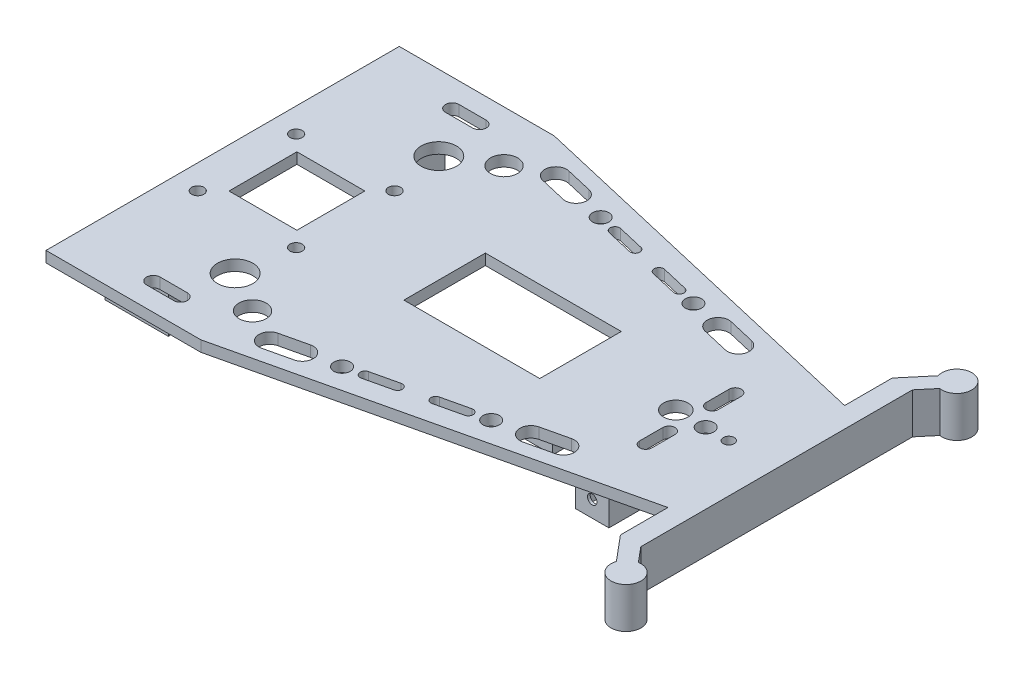
from build123d import *

# Parameters (mm, degrees)
SKETCH1_R           = 6.5
BOSS_EXTRUDE1_DEPTH = 4
CUT_EXTRUDE2_DEPTH  = 42
CUT_EXTRUDE4_DEPTH  = 27
SKETCH6_W           = 44
SKETCH6_H           = 44
SKETCH6_W_2         = 43
SKETCH6_H_2         = 43
EXTRUDE_THIN3_DEPTH = 1.5
SKETCH7_W           = 20
SKETCH7_H           = 10
CUT_EXTRUDE7_DEPTH  = 7
SKETCH9_W           = 85.5
SKETCH9_H           = 56
SKETCH9_W_2         = 84.5
SKETCH9_H_2         = 55
EXTRUDE_THIN4_DEPTH = 5
SKETCH11_R          = 5
SKETCH11_R_2        = 3
CUT_EXTRUDE11_DEPTH = 10
BOSS_EXTRUDE2_DEPTH = 15
SKETCH10_W          = 12.3
SKETCH10_H          = 12.3
SKETCH10_W_2        = 10.3
SKETCH10_H_2        = 10.3
EXTRUDE_THIN7_DEPTH = 15
SKETCH8_W           = 23.3
SKETCH8_H           = 16.3
SKETCH8_W_2         = 21.3
SKETCH8_H_2         = 14.3
EXTRUDE_THIN8_DEPTH = 15
SKETCH14_W          = 13
SKETCH14_H          = 130
CUT_EXTRUDE12_DEPTH = 36
RIB1_REACH          = 141.989
SKETCH15_WALL_W     = 297.533596482
SKETCH15_WALL_H     = 5
CUT_EXTRUDE13_DEPTH = 106
SKETCH17_R          = 1.75
CUT_EXTRUDE14_DEPTH = 106
SKETCH20_R          = 2.25
CUT_EXTRUDE15_DEPTH = 10
SKETCH23_R          = 3
SKETCH23_R_2        = 4.5
SKETCH23_R_3        = 2
CUT_EXTRUDE16_DEPTH = 10
CUT_EXTRUDE17_DEPTH = 10


with BuildPart() as part:
    # Sketch1 → Boss-Extrude1 (new body)
    with BuildSketch(Plane(origin=(0, 0, 0), x_dir=(1, 0, 0), z_dir=(0, 1, 0))):
        Polygon((-125, 65), (-125, -65), (-55, -65), (43.75, -65), (125, 0), (43.75, 65), (-55, 65), align=None)
        with BuildLine():
            Line((-72.500001663, -57.500000444), (-82.500001663, -57.500000444))
            ThreePointArc((-82.500001663, -57.500000444), (-85.000001835, -55.000000272), (-82.500001663, -52.500000099))
            Line((-82.500001663, -52.500000099), (-72.500001663, -52.500000099))
            ThreePointArc((-72.500001663, -52.500000099), (-70.000001491, -55.000000272), (-72.500001663, -57.500000444))
        make_face(mode=Mode.SUBTRACT)
        with Locations((-69.878159024, -37.517670743)):
            Circle(SKETCH1_R, mode=Mode.SUBTRACT)
        with Locations((-69.777174665, 37.319219168)):
            Circle(SKETCH1_R, mode=Mode.SUBTRACT)
        with BuildLine():
            ThreePointArc((-82.500001663, 52.499999922), (-85.000002008, 55.000000267), (-82.500001663, 57.500000612))
            Line((-82.500001663, 57.500000612), (-72.500001663, 57.500000612))
            ThreePointArc((-72.500001663, 57.500000612), (-70.000001146, 55.000000267), (-72.500001663, 52.499999922))
            Line((-72.500001663, 52.499999922), (-82.500001663, 52.499999922))
        make_face(mode=Mode.SUBTRACT)
    extrude(amount=BOSS_EXTRUDE1_DEPTH)

    # Sketch2 → Cut-Extrude2 (cut)
    with BuildSketch(Plane(origin=(0, 0, 0), x_dir=(1, 0, 0), z_dir=(0, 1, 0))):
        Polygon((84.375, 32.5), (84.375, -32.5), (125, 0), align=None)
    extrude(amount=CUT_EXTRUDE2_DEPTH, mode=Mode.SUBTRACT)

    # Sketch3 → Cut-Extrude4 (cut)
    with BuildSketch(Plane(origin=(0, 0, 0), x_dir=(1, 0, 0), z_dir=(0, 1, 0))):
        Polygon((84.375, -32.5), (-55, -65), (84.375, -65), align=None)
        Polygon((84.375, 32.5), (-55, 65), (84.375, 65), align=None)
    extrude(amount=CUT_EXTRUDE4_DEPTH, mode=Mode.SUBTRACT)

    # Sketch6 → Extrude-Thin3 (add)
    with BuildSketch(Plane(origin=(0, 0, 0), x_dir=(1, 0, 0), z_dir=(0, 1, 0))):
        with Locations((-85, 0)):
            Rectangle(SKETCH6_W, SKETCH6_H)
        with Locations((-85, 0)):
            Rectangle(SKETCH6_W_2, SKETCH6_H_2, mode=Mode.SUBTRACT)
    extrude(amount=-EXTRUDE_THIN3_DEPTH)

    # Sketch7 → Cut-Extrude7 (cut)
    with BuildSketch(Plane(origin=(0, 0, 0), x_dir=(1, 0, 0), z_dir=(0, 1, 0))):
        with Locations((-101.008888964, 0)):
            Rectangle(SKETCH7_W, SKETCH7_H)
    extrude(amount=-CUT_EXTRUDE7_DEPTH, mode=Mode.SUBTRACT)

    # Sketch9 → Extrude-Thin4 (add)
    with BuildSketch(Plane(origin=(0, 0, 0), x_dir=(1, 0, 0), z_dir=(0, 1, 0))):
        with Locations((-5.3125, 0)):
            Rectangle(SKETCH9_W, SKETCH9_H)
        with Locations((-5.3125, 0)):
            Rectangle(SKETCH9_W_2, SKETCH9_H_2, mode=Mode.SUBTRACT)
    extrude(amount=-EXTRUDE_THIN4_DEPTH)

    # Sketch11 → Cut-Extrude11 (cut)
    with BuildSketch(Plane(origin=(0, 0, 0), x_dir=(1, 0, 0), z_dir=(0, 1, 0))):
        with BuildLine():
            Line((-33.20955337, -46.452643612), (-42.948124964, -48.724256102))
            ThreePointArc((-42.948124964, -48.724256102), (-45.934908606, -53.528329735), (-41.130834972, -56.515113377))
            Line((-41.130834972, -56.515113377), (-31.392263378, -54.243500888))
            ThreePointArc((-31.392263378, -54.243500888), (-28.405479736, -49.439427254), (-33.20955337, -46.452643612))
        make_face()
        with BuildLine():
            ThreePointArc((17.61576882, -40.501520687), (18.922486663, -38.399738472), (16.820704448, -37.093020629))
            Line((16.820704448, -37.093020629), (7.082132854, -39.364633118))
            ThreePointArc((7.082132854, -39.364633118), (5.775415011, -41.466415333), (7.877197225, -42.773133176))
            Line((7.877197225, -42.773133176), (17.61576882, -40.501520687))
        make_face()
        with BuildLine():
            Line((-4.309012813, -42.021723896), (-14.047584407, -44.293336385))
            ThreePointArc((-14.047584407, -44.293336385), (-15.35430225, -46.3951186), (-13.252520036, -47.701836443))
            Line((-13.252520036, -47.701836443), (-3.513948441, -45.430223954))
            ThreePointArc((-3.513948441, -45.430223954), (-2.207230598, -43.328441739), (-4.309012813, -42.021723896))
        make_face()
        with BuildLine():
            ThreePointArc((46.516309376, -36.07060097), (49.503093018, -31.266527337), (44.699019385, -28.279743695))
            Line((44.699019385, -28.279743695), (34.96044779, -30.551356184))
            ThreePointArc((34.96044779, -30.551356184), (31.973664149, -35.355429818), (36.777737782, -38.34221346))
            Line((36.777737782, -38.34221346), (46.516309376, -36.07060097))
        make_face()
        with BuildLine():
            Line((34.96044779, 30.551356184), (44.699019385, 28.279743695))
            ThreePointArc((44.699019385, 28.279743695), (49.503093018, 31.266527337), (46.516309376, 36.07060097))
            Line((46.516309376, 36.07060097), (36.777737782, 38.34221346))
            ThreePointArc((36.777737782, 38.34221346), (31.973664149, 35.355429818), (34.96044779, 30.551356184))
        make_face()
        with BuildLine():
            Line((7.082132854, 39.364633118), (16.820704448, 37.093020629))
            ThreePointArc((16.820704448, 37.093020629), (18.922486663, 38.399738472), (17.61576882, 40.501520687))
            Line((17.61576882, 40.501520687), (7.877197225, 42.773133176))
            ThreePointArc((7.877197225, 42.773133176), (5.775415011, 41.466415333), (7.082132854, 39.364633118))
        make_face()
        with BuildLine():
            ThreePointArc((-13.252520036, 47.701836443), (-15.35430225, 46.3951186), (-14.047584407, 44.293336385))
            Line((-14.047584407, 44.293336385), (-4.309012813, 42.021723896))
            ThreePointArc((-4.309012813, 42.021723896), (-2.207230598, 43.328441739), (-3.513948441, 45.430223954))
            Line((-3.513948441, 45.430223954), (-13.252520036, 47.701836443))
        make_face()
        with BuildLine():
            ThreePointArc((-41.130834972, 56.515113377), (-45.934908606, 53.528329735), (-42.948124964, 48.724256102))
            Line((-42.948124964, 48.724256102), (-33.20955337, 46.452643612))
            ThreePointArc((-33.20955337, 46.452643612), (-28.405479736, 49.439427254), (-31.392263378, 54.243500888))
            Line((-31.392263378, 54.243500888), (-41.130834972, 56.515113377))
        make_face()
        with Locations((-54.722714458, -46.267670743)):
            Circle(SKETCH11_R)
        with Locations((-20.467052337, -47.587715157)):
            Circle(SKETCH11_R_2)
        with Locations((24.03523675, -37.207141915)):
            Circle(SKETCH11_R_2)
        with Locations((24.03523675, 37.207141915)):
            Circle(SKETCH11_R_2)
        with Locations((-20.467052337, 47.587715157)):
            Circle(SKETCH11_R_2)
        with Locations((-54.722714458, 46.267670743)):
            Circle(SKETCH11_R)
    extrude(amount=CUT_EXTRUDE11_DEPTH, mode=Mode.SUBTRACT)

    # Sketch12 → Boss-Extrude2 (add)
    with BuildSketch(Plane(origin=(0, 4, 0), x_dir=(1, 0, 0), z_dir=(0, 1, 0))):
        with BuildLine():
            Line((84.375, 50), (84.375, -50))
            Line((84.375, -50), (92.081594526, -59.184361713))
            ThreePointArc((92.081594526, -59.184361713), (100.888996468, -65.05979887), (96.447425051, -55.449203982))
            Line((96.447425051, -55.449203982), (91.875, -50))
            Line((91.875, -50), (91.875, 50))
            Line((91.875, 50), (96.447425051, 55.449203982))
            ThreePointArc((96.447425051, 55.449203982), (100.888996468, 65.05979887), (92.081594526, 59.184361713))
            Line((92.081594526, 59.184361713), (84.375, 50))
        make_face()
    extrude(amount=-BOSS_EXTRUDE2_DEPTH)

    # Sketch10 → Extrude-Thin7 (add)
    with BuildSketch(Plane(origin=(0, 4, 0), x_dir=(1, 0, 0), z_dir=(0, 1, 0))):
        with Locations((58.875, -28.723094171)):
            Rectangle(SKETCH10_W, SKETCH10_H)
        with Locations((58.875, -28.723094171)):
            Rectangle(SKETCH10_W_2, SKETCH10_H_2, mode=Mode.SUBTRACT)
    extrude_thin7 = extrude(amount=-EXTRUDE_THIN7_DEPTH)

    # Mirror4: Extrude-Thin7 across plane
    add(extrude_thin7.mirror(Plane.XY))

    # Sketch8 → Extrude-Thin8 (add)
    with BuildSketch(Plane(origin=(0, 0, 0), x_dir=(1, 0, 0), z_dir=(0, 1, 0))):
        with Locations((-92.75, -42.75)):
            Rectangle(SKETCH8_W, SKETCH8_H)
        with Locations((-92.75, -42.75)):
            Rectangle(SKETCH8_W_2, SKETCH8_H_2, mode=Mode.SUBTRACT)
    extrude_thin8 = extrude(amount=-EXTRUDE_THIN8_DEPTH)

    # Mirror5: Extrude-Thin8 across plane
    add(extrude_thin8.mirror(Plane.XY))

    # Sketch14 → Cut-Extrude12 (cut)
    with BuildSketch(Plane.XZ):
        with Locations((-118.5, 0)):
            Rectangle(SKETCH14_W, SKETCH14_H)
    extrude(amount=-CUT_EXTRUDE12_DEPTH, mode=Mode.SUBTRACT)

    # Sketch15 wall → Rib1 (add, up to next)
    with BuildSketch(Plane(origin=(78.874995353, -5.5, 16.25), x_dir=(0.707107079939, -0.707106482434, 0), z_dir=(0.707106482434, 0.707107079939, 0)), mode=Mode.PRIVATE) as rib1_sk1:
        Rectangle(SKETCH15_WALL_W, SKETCH15_WALL_H)
    rib1_tool1 = extrude(rib1_sk1.sketch, amount=RIB1_REACH, mode=Mode.PRIVATE) - part.part
    rib1 = rib1_tool1.solids().sort_by_distance((78.874995353, -5.5, 16.25))[0]
    add(rib1)

    # Mirror6: Rib1 across plane
    add(rib1.mirror(Plane.XY))

    # Sketch16 → Cut-Extrude13 (cut)
    with BuildSketch(Plane.XY.offset(34.873094171)):
        with BuildLine():
            ThreePointArc((58.875, -3.25), (57.637563133, -6.237436867), (60.625, -5))
            ThreePointArc((60.625, -5), (60.112436867, -3.762563133), (58.875, -3.25))
        make_face()
    extrude(amount=-CUT_EXTRUDE13_DEPTH, mode=Mode.SUBTRACT)

    # Sketch17 → Cut-Extrude14 (cut)
    with BuildSketch(Plane.XY.offset(50.9)):
        with Locations((-92.1, -6.5)):
            Circle(SKETCH17_R)
    extrude(amount=-CUT_EXTRUDE14_DEPTH, mode=Mode.SUBTRACT)

    # Sketch20 → Cut-Extrude15 (cut)
    with BuildSketch(Plane(origin=(0, 4, 0), x_dir=(1, 0, 0), z_dir=(0, 1, 0))):
        Polygon((-97.253961831, 0), (-97.253961831, -12.415341268), (-72.253961831, -12.415341268), (-72.253961831, 12.584658732), (-97.253961831, 12.584658732), align=None)
        with Locations((-103.063113255, -18.092954404)):
            Circle(SKETCH20_R)
        with Locations((-103.063113255, 18.107045596)):
            Circle(SKETCH20_R)
        with Locations((-66.863113255, 18.107045596)):
            Circle(SKETCH20_R)
        with Locations((-66.863113255, -18.092954404)):
            Circle(SKETCH20_R)
    extrude(amount=-CUT_EXTRUDE15_DEPTH, mode=Mode.SUBTRACT)

    # Sketch23 → Cut-Extrude16 (cut)
    with BuildSketch(Plane(origin=(0, 4, 0), x_dir=(1, 0, 0), z_dir=(0, 1, 0))):
        with Locations((65.750670765, 0)):
            Circle(SKETCH23_R)
        with Locations((54.750670765, 0)):
            Circle(SKETCH23_R_2)
        with Locations((74.250670765, 0)):
            Circle(SKETCH23_R_3)
        with BuildLine():
            Line((57.929214629, 16.462030373), (57.929214629, 7.962030373))
            ThreePointArc((57.929214629, 7.962030373), (60.179214629, 5.712030373), (62.429214629, 7.962030373))
            Line((62.429214629, 7.962030373), (62.429214629, 16.462030373))
            ThreePointArc((62.429214629, 16.462030373), (60.179214629, 18.712030373), (57.929214629, 16.462030373))
        make_face()
        with BuildLine():
            ThreePointArc((62.429214629, -7.962030373), (60.179214629, -5.712030373), (57.929214629, -7.962030373))
            Line((57.929214629, -7.962030373), (57.929214629, -16.462030373))
            ThreePointArc((57.929214629, -16.462030373), (60.179214629, -18.712030373), (62.429214629, -16.462030373))
            Line((62.429214629, -16.462030373), (62.429214629, -7.962030373))
        make_face()
    extrude(amount=-CUT_EXTRUDE16_DEPTH, mode=Mode.SUBTRACT)

    # Sketch24 → Cut-Extrude17 (cut)
    with BuildSketch(Plane(origin=(0, 4, 0), x_dir=(1, 0, 0), z_dir=(0, 1, 0))):
        Polygon((19.687499995, 15), (-30.312500005, 15), (-30.312500005, -15), (19.687499995, -15), (19.687499995, 0), align=None)
    extrude(amount=-CUT_EXTRUDE17_DEPTH, mode=Mode.SUBTRACT)


solid = part.part
